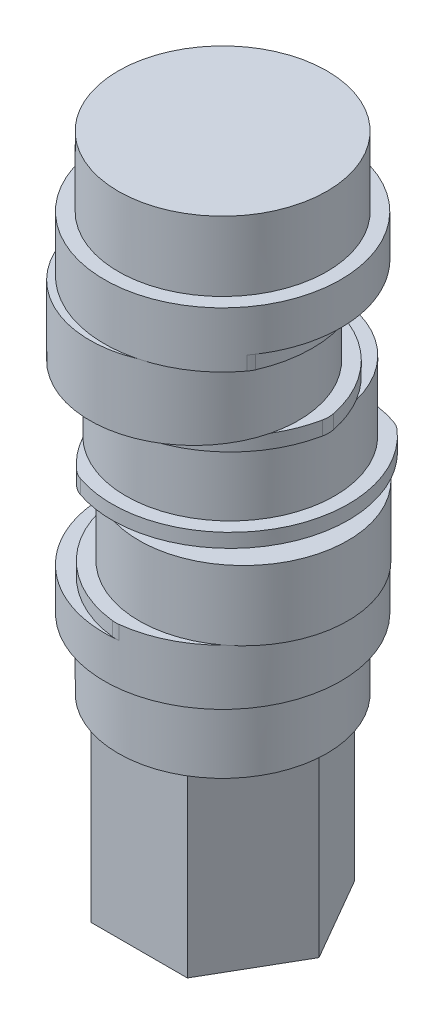
from build123d import *

# Parameters (mm, degrees)
BOSS_EXTRUDE1_DEPTH  = 13
SKETCH5_R            = 7.5
BOSS_EXTRUDE2_DEPTH  = 8
BOSS_EXTRUDE3_DEPTH  = 1
SKETCH7_R            = 7.5
BOSS_EXTRUDE4_DEPTH  = 5
BOSS_EXTRUDE5_DEPTH  = 1
SKETCH9_R            = 7.5
BOSS_EXTRUDE6_DEPTH  = 5
BOSS_EXTRUDE7_DEPTH  = 1
SKETCH12_R           = 7.5
BOSS_EXTRUDE8_DEPTH  = 5
BOSS_EXTRUDE9_DEPTH  = 1
SKETCH14_R           = 7.5
BOSS_EXTRUDE10_DEPTH = 8
FILLET1_R            = 2
BOSS_EXTRUDE11_START = 3
SKETCH15_R           = 8.5
BOSS_EXTRUDE11_DEPTH = 3
SKETCH16_R           = 8.5
BOSS_EXTRUDE12_DEPTH = 3


with BuildPart() as part:
    # Sketch4 → Boss-Extrude1 (new body)
    with BuildSketch(Plane(origin=(0, 0, 0), x_dir=(1, 0, 0), z_dir=(0, 1, 0))):
        Polygon((-3.464101615, 6), (-6.92820323, 0), (-3.464101615, -6), (3.464101615, -6), (6.92820323, 0), (3.464101615, 6), align=None)
    extrude(amount=BOSS_EXTRUDE1_DEPTH)

    # Sketch5 → Boss-Extrude2 (add)
    with BuildSketch(Plane(origin=(0, 13, 0), x_dir=(1, 0, 0), z_dir=(0, 1, 0))):
        with Locations(Location((0, 0, 0), (0, 0, 270))):
            Circle(SKETCH5_R)
    extrude(amount=BOSS_EXTRUDE2_DEPTH)

    # Sketch6 → Boss-Extrude3 (add)
    with BuildSketch(Plane(origin=(0, 21, 0), x_dir=(1, 0, 0), z_dir=(0, 1, 0))):
        with BuildLine():
            ThreePointArc((0.75, -8.466847111), (6.269968102, -5.739120142), (8.5, 0))
            ThreePointArc((8.5, 0), (6.269968102, 5.739120142), (0.75, 8.466847111))
            ThreePointArc((0.75, 8.466847111), (-7, 0), (0.75, -8.466847111))
        make_face()
    extrude(amount=BOSS_EXTRUDE3_DEPTH)

    # Sketch7 → Boss-Extrude4 (add)
    with BuildSketch(Plane(origin=(0, 22, 0), x_dir=(1, 0, 0), z_dir=(0, 1, 0))):
        with Locations(Location((1.5, 0, 0), (0, 0, 52.330113036))):
            Circle(SKETCH7_R)
    extrude(amount=BOSS_EXTRUDE4_DEPTH)

    # Sketch8 → Boss-Extrude5 (add)
    with BuildSketch(Plane(origin=(0, 27, 0), x_dir=(1, 0, 0), z_dir=(0, 1, 0))):
        with BuildLine():
            ThreePointArc((7.75, 1.299038106), (6.915283179, 4.972379062), (4.575074404, 7.924261316))
            ThreePointArc((4.575074404, 7.924261316), (-5.861215932, 4.25), (-3.825074404, -6.625223211))
            ThreePointArc((-3.825074404, -6.625223211), (4.051659482, -5.714810069), (7.75, 1.299038106))
        make_face()
    extrude(amount=BOSS_EXTRUDE5_DEPTH)

    # Sketch9 → Boss-Extrude6 (add)
    with BuildSketch(Plane(origin=(0, 28, 0), x_dir=(1, 0, 0), z_dir=(0, 1, 0))):
        with Locations(Location((-0.75, 1.299038106, 0), (0, 0, 73.730489259))):
            Circle(SKETCH9_R)
    extrude(amount=BOSS_EXTRUDE6_DEPTH)

    # Sketch11 → Boss-Extrude7 (add)
    with BuildSketch(Plane(origin=(0, 33, 0), x_dir=(1, 0, 0), z_dir=(0, 1, 0))):
        with BuildLine():
            ThreePointArc((7.650148808, 0), (-0.75, 7.200961894), (-9.150148808, 0))
            ThreePointArc((-9.150148808, 0), (-0.75, -7.200961894), (7.650148808, 0))
        make_face()
    extrude(amount=BOSS_EXTRUDE7_DEPTH)

    # Sketch12 → Boss-Extrude8 (add)
    with BuildSketch(Plane(origin=(0, 34, 0), x_dir=(1, 0, 0), z_dir=(0, 1, 0))):
        with Locations(Location((-0.75, -1.299038106, 0), (0, 0, 193.730489259))):
            Circle(SKETCH12_R)
    extrude(amount=BOSS_EXTRUDE8_DEPTH)

    # Sketch13 → Boss-Extrude9 (add)
    with BuildSketch(Plane(origin=(0, 39, 0), x_dir=(1, 0, 0), z_dir=(0, 1, 0))):
        with BuildLine():
            ThreePointArc((6.957504688, -4.882942608), (7.549511728, -3.134277893), (7.75, -1.299038106))
            ThreePointArc((7.75, -1.299038106), (1.810391586, 6.806169783), (-7.707504688, 3.583904503))
            ThreePointArc((-7.707504688, 3.583904503), (-4.25, -7.361215932), (6.957504688, -4.882942608))
        make_face()
    extrude(amount=BOSS_EXTRUDE9_DEPTH)

    # Sketch14 → Boss-Extrude10 (add)
    with BuildSketch(Plane(origin=(0, 40, 0), x_dir=(1, 0, 0), z_dir=(0, 1, 0))):
        with Locations(Location((0, 0, 0), (0, 0, 127.669886964))):
            Circle(SKETCH14_R)
    extrude(amount=BOSS_EXTRUDE10_DEPTH)

    # Fillet1
    fillet1_edges = [part.edges().sort_by_distance(p)[0] for p in [
        (0.75, 21.5, -8.466847111),
        (0.75, 21.5, 8.466847111),
        (-3.825074404, 27.5, 6.625223211),
        (4.575074404, 27.5, -7.924261316),
        (7.650148808, 33.5, 0),
        (-9.150148808, 33.5, 0),
        (-7.707504688, 39.5, -3.583904503),
        (6.957504688, 39.5, 4.882942608),
    ]]
    fillet(fillet1_edges, radius=FILLET1_R)

    # Sketch15 → Boss-Extrude11 (add)
    with BuildSketch(Plane.XZ.offset(-21).offset(BOSS_EXTRUDE11_START)):
        with Locations(Location((0, 0, 0), (0, 0, 270))):
            Circle(SKETCH15_R)
    extrude(amount=-BOSS_EXTRUDE11_DEPTH)

    # Sketch16 → Boss-Extrude12 (add)
    with BuildSketch(Plane.XZ.offset(-40)):
        with Locations(Location((0, 0, 0), (0, 0, 270))):
            Circle(SKETCH16_R)
    extrude(amount=-BOSS_EXTRUDE12_DEPTH)


solid = part.part
